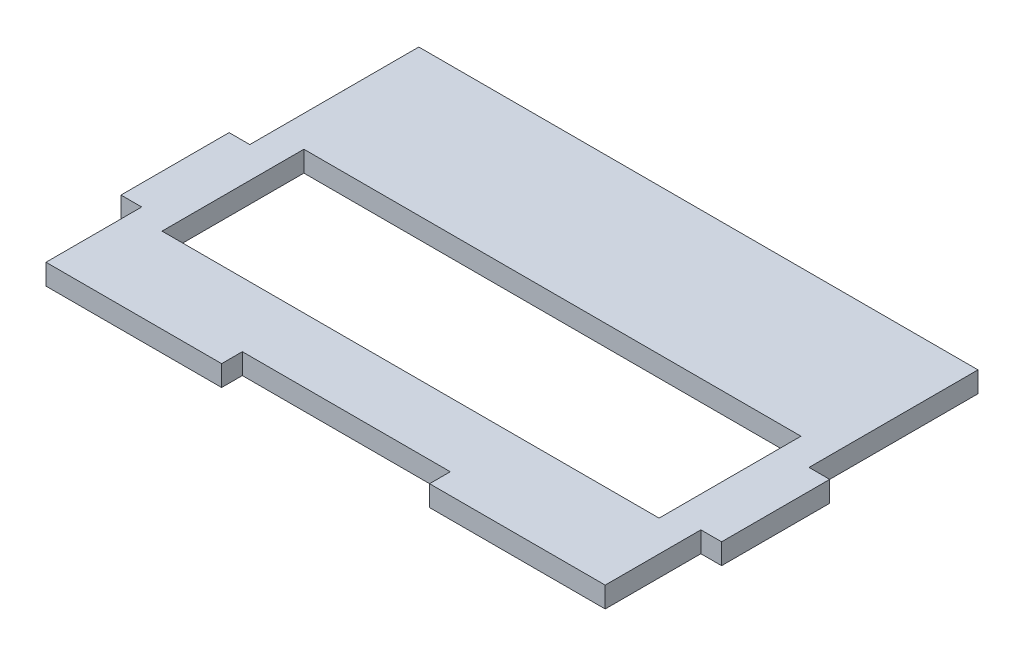
from build123d import *

# Parameters (mm, degrees)
SKETCH1_W           = 145
SKETCH1_H           = 90
BOSS_EXTRUDE1_DEPTH = 5
SKETCH3_W           = 120
SKETCH3_H           = 34.25
CUT_EXTRUDE1_DEPTH  = 5
SKETCH4_W           = 5
SKETCH4_H           = 40.8
SKETCH4_H_2         = 23.1
CUT_EXTRUDE2_DEPTH  = 5
SKETCH7_W           = 50.2
SKETCH7_H           = 5
CUT_EXTRUDE3_DEPTH  = 5


with BuildPart() as part:
    # Sketch1 → Boss-Extrude1 (new body)
    with BuildSketch(Plane(origin=(0, 0, 0), x_dir=(1, 0, 0), z_dir=(0, 1, 0))):
        Rectangle(SKETCH1_W, SKETCH1_H)
    extrude(amount=BOSS_EXTRUDE1_DEPTH)

    # Sketch3 → Cut-Extrude1 (cut)
    with BuildSketch(Plane(origin=(0, 5, 0), x_dir=(1, 0, 0), z_dir=(0, 1, 0))):
        with Locations((0, -7.365)):
            Rectangle(SKETCH3_W, SKETCH3_H)
    extrude(amount=-CUT_EXTRUDE1_DEPTH, mode=Mode.SUBTRACT)

    # Sketch4 → Cut-Extrude2 (cut)
    with BuildSketch(Plane(origin=(0, 5, 0), x_dir=(1, 0, 0), z_dir=(0, 1, 0))):
        with Locations((-70, 24.6)):
            Rectangle(SKETCH4_W, SKETCH4_H)
        with Locations((-70, -33.45)):
            Rectangle(SKETCH4_W, SKETCH4_H_2)
        with Locations((70, -33.45)):
            Rectangle(SKETCH4_W, SKETCH4_H_2)
        with Locations((70, 24.6)):
            Rectangle(SKETCH4_W, SKETCH4_H)
    extrude(amount=-CUT_EXTRUDE2_DEPTH, mode=Mode.SUBTRACT)

    # Sketch7 → Cut-Extrude3 (cut)
    with BuildSketch(Plane(origin=(0, 5, 0), x_dir=(1, 0, 0), z_dir=(0, 1, 0))):
        with Locations((0, -42.5)):
            Rectangle(SKETCH7_W, SKETCH7_H)
    extrude(amount=-CUT_EXTRUDE3_DEPTH, mode=Mode.SUBTRACT)


solid = part.part
